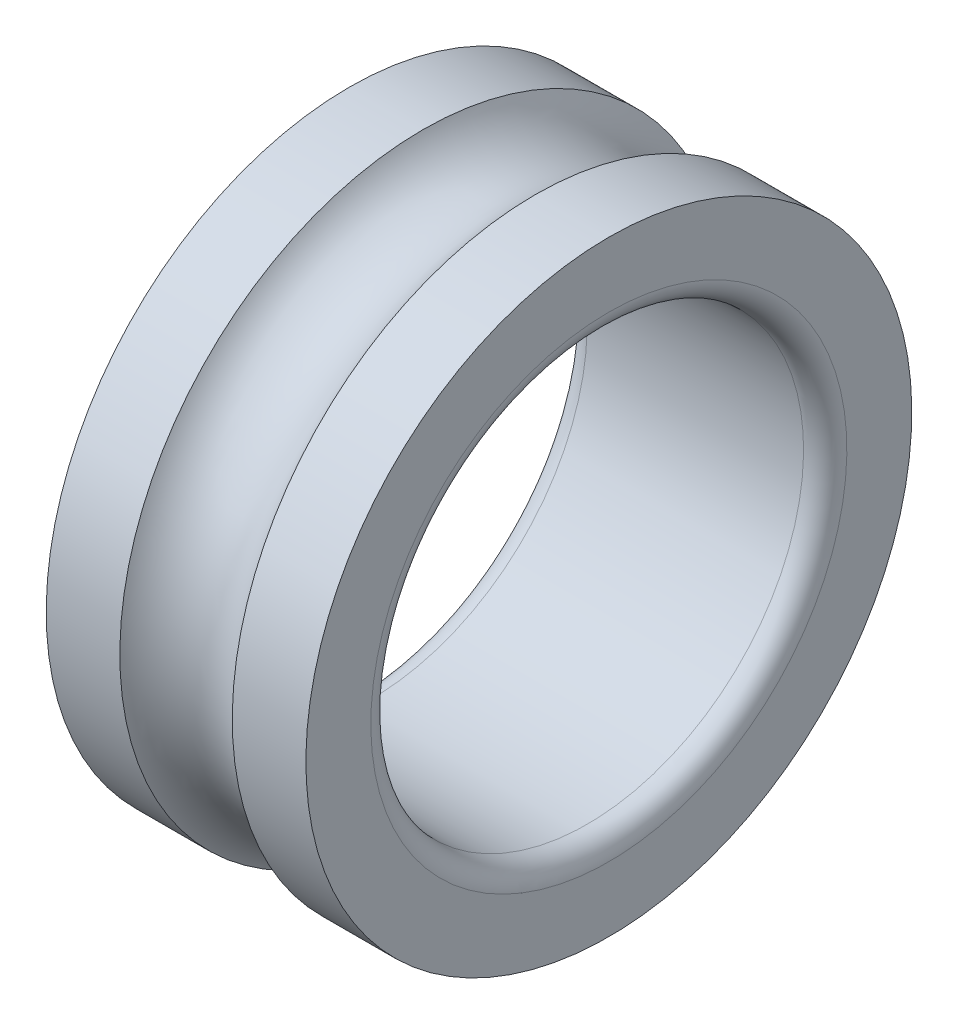
from build123d import *


with BuildPart() as part:
    # Esquisse1 → Base-Révolution (revolve)
    with BuildSketch(Plane.XY):
        with BuildLine():
            Line((-6, 97.5), (4, 97.5))
            ThreePointArc((4, 97.5), (4.707106781, 97.792893219), (5, 98.5))
            Line((5, 98.5), (5, 101.5))
            Line((5, 101.5), (1.598076211, 101.5))
            ThreePointArc((1.598076211, 101.5), (-1, 100), (-3.598076211, 101.5))
            Line((-3.598076211, 101.5), (-7, 101.5))
            Line((-7, 101.5), (-7, 98.5))
            ThreePointArc((-7, 98.5), (-6.707106781, 97.792893219), (-6, 97.5))
        make_face()
    revolve(axis=Axis((20, 87.5, 0), (-1, 0, 0)))


solid = part.part
